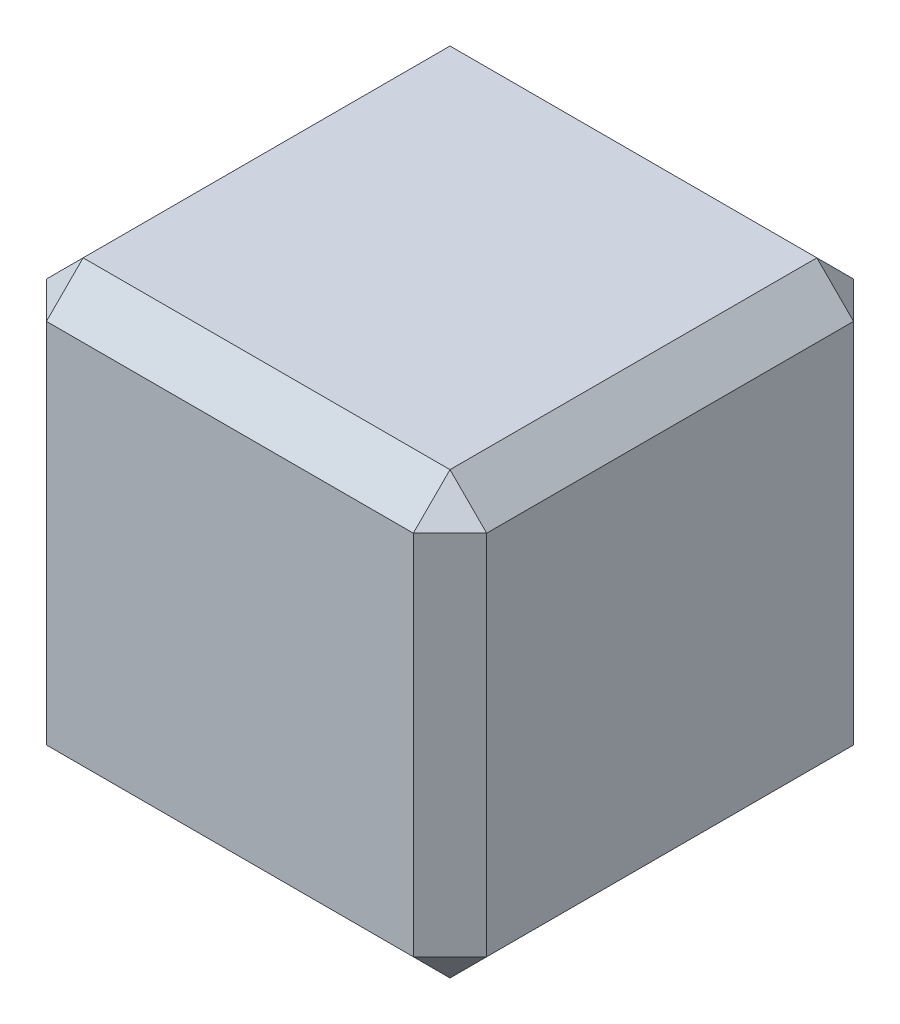
from build123d import *

# Parameters (mm, degrees)
SKETCH1_W           = 6
SKETCH1_H           = 6
BOSS_EXTRUDE1_DEPTH = 3
CHAMFER1_SIZE       = 0.5


with BuildPart() as part:
    # Sketch1 → Boss-Extrude1 (new, symmetric)
    with BuildSketch(Plane(origin=(0, 0, 0), x_dir=(1, 0, 0), z_dir=(0, 1, 0))):
        Rectangle(SKETCH1_W, SKETCH1_H)
    extrude(amount=BOSS_EXTRUDE1_DEPTH, both=True)

    # Chamfer1
    chamfer1_edges = [part.edges().sort_by_distance(p)[0] for p in [
        (-3, 3, 0),
        (0, 3, 3),
        (3, 3, 0),
        (0, -3, 3),
        (-3, -3, 0),
        (0, -3, -3),
        (3, -3, 0),
        (3, 0, 3),
        (-3, 0, 3),
        (-3, 0, -3),
        (3, 0, -3),
        (0, 3, -3),
    ]]
    chamfer(chamfer1_edges, length=CHAMFER1_SIZE)


solid = part.part
